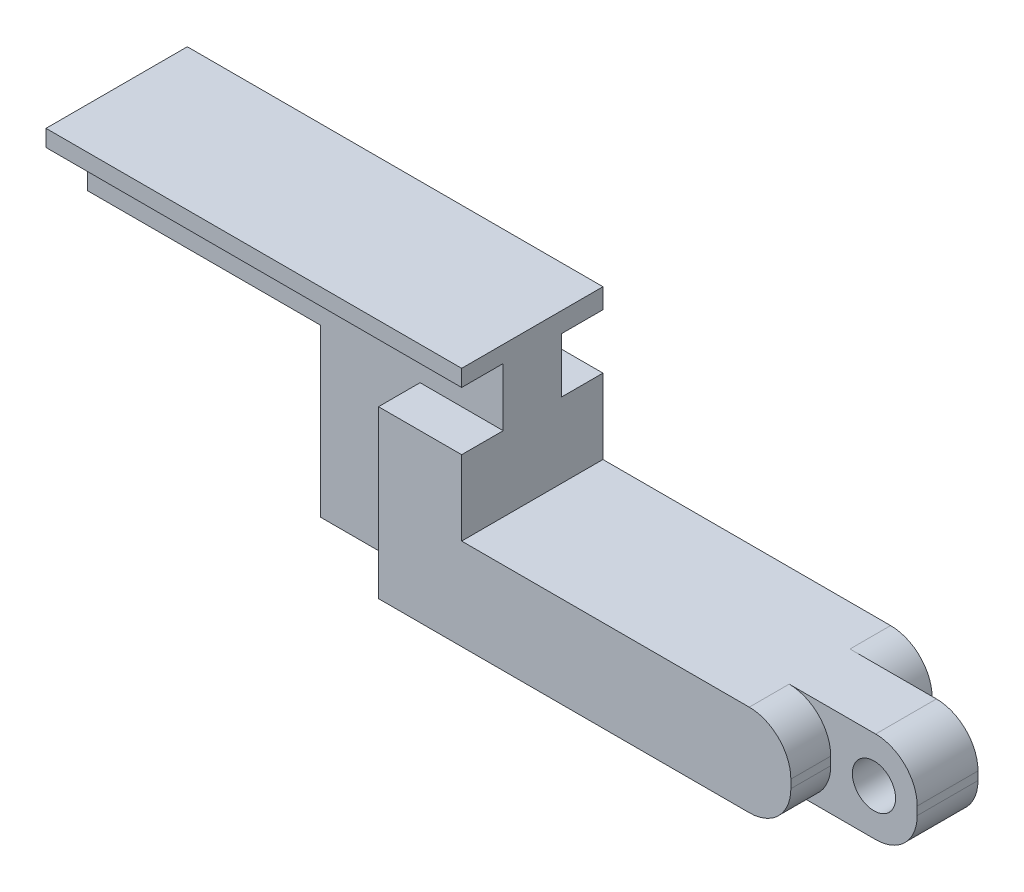
from build123d import *

# Parameters (mm, degrees)
SKETCH1_W           = 21.59
SKETCH1_H           = 36.83
BOSS_EXTRUDE1_DEPTH = 127
SKETCH2_W           = 50.8
SKETCH2_H           = 25.4
CUT_EXTRUDE1_DEPTH  = 25.4
SKETCH3_W           = 63.5
SKETCH3_H           = 22.86
CUT_EXTRUDE2_DEPTH  = 22.86
SKETCH4_W           = 6.35
SKETCH4_H           = 8.382
CUT_EXTRUDE3_DEPTH  = 69.85
SKETCH5_W           = 6.35
SKETCH5_H           = 8.89
CUT_EXTRUDE4_DEPTH  = 69.85
SKETCH6_W           = 6.096
SKETCH6_H           = 13.97
CUT_EXTRUDE5_DEPTH  = 13.208
SKETCH7_W           = 6.205413724
SKETCH7_H           = 13.97
CUT_EXTRUDE6_DEPTH  = 13.208
SKETCH8_R           = 3.302
CUT_EXTRUDE7_DEPTH  = 13.208
FILLET1_R           = 6.35
FILLET2_R           = 6.35
FILLET3_R           = 6.35
FILLET4_R           = 6.35
FILLET5_R           = 6.35
FILLET6_R           = 6.35
SKETCH9_W           = 15.24
SKETCH9_H           = 8.89
BOSS_EXTRUDE2_DEPTH = 25.4


with BuildPart() as part:
    # Sketch1 → Boss-Extrude1 (new body)
    with BuildSketch(Plane(origin=(0, 0, 0), x_dir=(0, 0, -1), z_dir=(1, 0, 0))):
        with Locations((10.795, -18.415)):
            Rectangle(SKETCH1_W, SKETCH1_H)
    extrude(amount=BOSS_EXTRUDE1_DEPTH)

    # Sketch2 → Cut-Extrude1 (cut)
    with BuildSketch(Plane.XY):
        with Locations((25.4, -24.13)):
            Rectangle(SKETCH2_W, SKETCH2_H)
    extrude(amount=-CUT_EXTRUDE1_DEPTH, mode=Mode.SUBTRACT)

    # Sketch3 → Cut-Extrude2 (cut)
    with BuildSketch(Plane.XY):
        with Locations((95.25, -11.43)):
            Rectangle(SKETCH3_W, SKETCH3_H)
    extrude(amount=-CUT_EXTRUDE2_DEPTH, mode=Mode.SUBTRACT)

    # Sketch4 → Cut-Extrude3 (cut)
    with BuildSketch(Plane.ZY):
        with Locations((-18.415, -7.239)):
            Rectangle(SKETCH4_W, SKETCH4_H)
    extrude(amount=-CUT_EXTRUDE3_DEPTH, mode=Mode.SUBTRACT)

    # Sketch5 → Cut-Extrude4 (cut)
    with BuildSketch(Plane.ZY):
        with Locations((-3.175, -6.985)):
            Rectangle(SKETCH5_W, SKETCH5_H)
    extrude(amount=-CUT_EXTRUDE4_DEPTH, mode=Mode.SUBTRACT)

    # Sketch6 → Cut-Extrude5 (cut)
    with BuildSketch(Plane(origin=(127, 0, 0), x_dir=(0, 0, -1), z_dir=(1, 0, 0))):
        with Locations((3.048, -29.845)):
            Rectangle(SKETCH6_W, SKETCH6_H)
    extrude(amount=-CUT_EXTRUDE5_DEPTH, mode=Mode.SUBTRACT)

    # Sketch7 → Cut-Extrude6 (cut)
    with BuildSketch(Plane(origin=(127, 0, 0), x_dir=(0, 0, -1), z_dir=(1, 0, 0))):
        with Locations((18.487293138, -29.845)):
            Rectangle(SKETCH7_W, SKETCH7_H)
    extrude(amount=-CUT_EXTRUDE6_DEPTH, mode=Mode.SUBTRACT)

    # Sketch8 → Cut-Extrude7 (cut)
    with BuildSketch(Plane.XY.offset(-6.096)):
        with Locations((120.396, -29.845)):
            Circle(SKETCH8_R)
    extrude(amount=-CUT_EXTRUDE7_DEPTH, mode=Mode.SUBTRACT)

    # Fillet1
    fillet1_edges = [part.edges().sort_by_distance(p)[0] for p in [
        (113.792, -22.86, -3.048),
    ]]
    fillet(fillet1_edges, radius=FILLET1_R)

    # Fillet2
    fillet2_edges = [part.edges().sort_by_distance(p)[0] for p in [
        (113.792, -36.83, -3.048),
    ]]
    fillet(fillet2_edges, radius=FILLET2_R)

    # Fillet3
    fillet3_edges = [part.edges().sort_by_distance(p)[0] for p in [
        (113.792, -22.86, -18.487293138),
    ]]
    fillet(fillet3_edges, radius=FILLET3_R)

    # Fillet4
    fillet4_edges = [part.edges().sort_by_distance(p)[0] for p in [
        (113.792, -36.83, -18.487293138),
    ]]
    fillet(fillet4_edges, radius=FILLET4_R)

    # Fillet5
    fillet5_edges = [part.edges().sort_by_distance(p)[0] for p in [
        (127, -22.86, -10.740293138),
    ]]
    fillet(fillet5_edges, radius=FILLET5_R)

    # Fillet6
    fillet6_edges = [part.edges().sort_by_distance(p)[0] for p in [
        (127, -36.83, -10.740293138),
    ]]
    fillet(fillet6_edges, radius=FILLET6_R)

    # Sketch9 → Boss-Extrude2 (add)
    with BuildSketch(Plane.XZ.offset(11.43)):
        with Locations((43.18, -10.795)):
            Rectangle(SKETCH9_W, SKETCH9_H)
    extrude(amount=BOSS_EXTRUDE2_DEPTH)


solid = part.part
